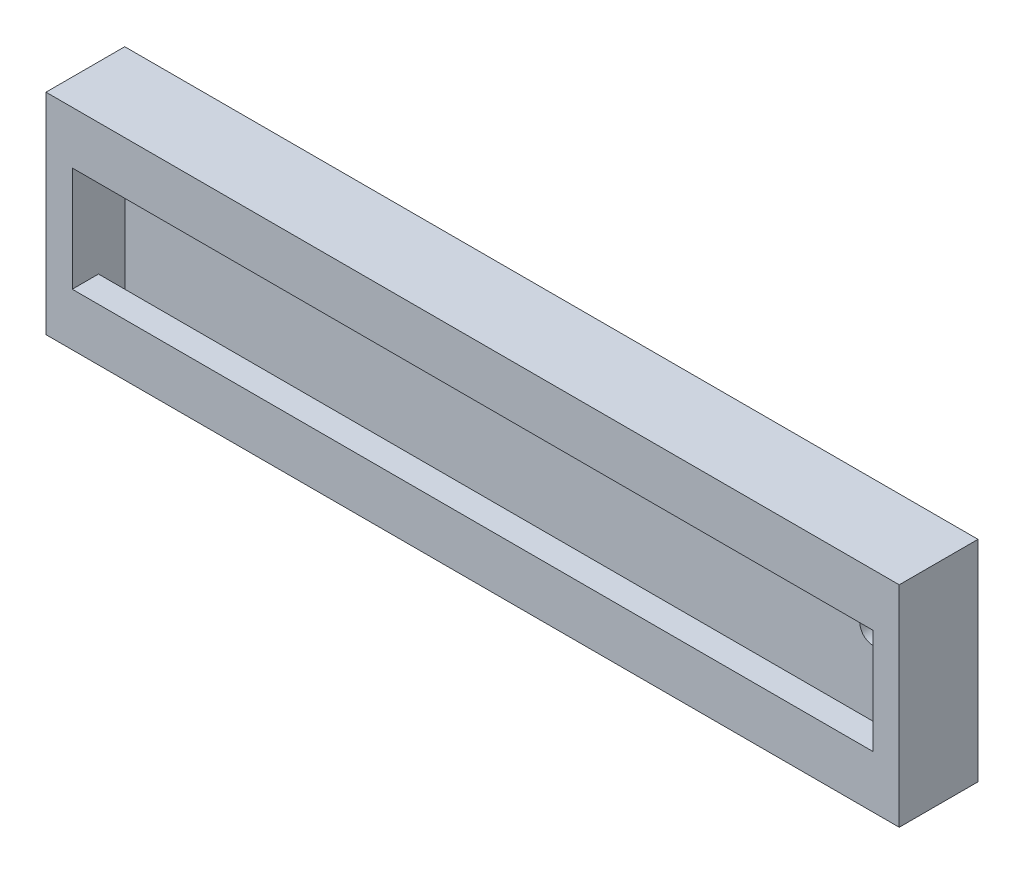
from build123d import *

# Parameters (mm, degrees)
SKETCH1_W           = 65
SKETCH1_H           = 16
BOSS_EXTRUDE1_DEPTH = 2
SKETCH2_W           = 65
SKETCH2_H           = 16
SKETCH2_W_2         = 61
SKETCH2_H_2         = 12
BOSS_EXTRUDE2_DEPTH = 2
SKETCH4_W           = 65
SKETCH4_H           = 16
SKETCH4_W_2         = 61
SKETCH4_H_2         = 8
BOSS_EXTRUDE3_DEPTH = 2
SKETCH6_R           = 1
CUT_EXTRUDE2_DEPTH  = 34.708307581


with BuildPart() as part:
    # Sketch1 → Boss-Extrude1 (new body)
    with BuildSketch(Plane.XY):
        Rectangle(SKETCH1_W, SKETCH1_H)
    extrude(amount=BOSS_EXTRUDE1_DEPTH)

    # Sketch2 → Boss-Extrude2 (add)
    with BuildSketch(Plane.XY.offset(2)):
        Rectangle(SKETCH2_W, SKETCH2_H)
        Rectangle(SKETCH2_W_2, SKETCH2_H_2, mode=Mode.SUBTRACT)
    extrude(amount=BOSS_EXTRUDE2_DEPTH)

    # Sketch4 → Boss-Extrude3 (add)
    with BuildSketch(Plane.XY.offset(4)):
        Rectangle(SKETCH4_W, SKETCH4_H)
        Rectangle(SKETCH4_W_2, SKETCH4_H_2, mode=Mode.SUBTRACT)
    extrude(amount=BOSS_EXTRUDE3_DEPTH)

    # Sketch6 → Cut-Extrude2 (cut, through all)
    with BuildSketch(Plane.XY.offset(2)):
        with Locations((26.5, 0)):
            Circle(SKETCH6_R)
    extrude(amount=-CUT_EXTRUDE2_DEPTH, mode=Mode.SUBTRACT)


solid = part.part
